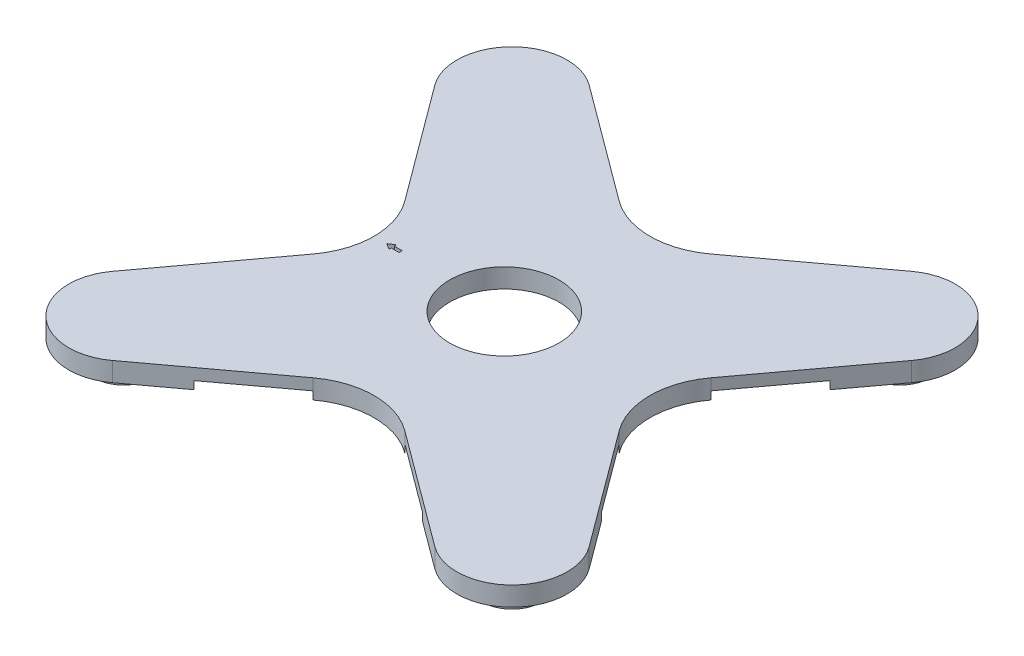
from build123d import *

# Parameters (mm, degrees)
SKETCH1_R           = 5
SKETCH1_R_2         = 9.017
BOSS_EXTRUDE1_DEPTH = 3.175
BOSS_EXTRUDE2_START = -3.175
SKETCH1_3_R         = 5
BOSS_EXTRUDE2_DEPTH = 6.35
CUT_EXTRUDE1_DEPTH  = 1.3


with BuildPart() as part:
    # Sketch1 → Boss-Extrude1 (new body)
    with BuildSketch(Plane(origin=(0, 0, 0), x_dir=(1, 0, 0), z_dir=(0, 1, 0))):
        with BuildLine():
            Line((-39.315149004, 26.587226943), (-25.231781425, 7.554111896))
            ThreePointArc((-25.231781425, 7.554111896), (-22.740865295, 0), (-25.231781425, -7.554111896))
            Line((-25.231781425, -7.554111896), (-39.315149004, -26.587226943))
            ThreePointArc((-39.315149004, -26.587226943), (-38.434652948, -38.434652948), (-26.587226943, -39.315149004))
            Line((-26.587226943, -39.315149004), (-7.554111896, -25.231781425))
            ThreePointArc((-7.554111896, -25.231781425), (0, -22.740865295), (7.554111896, -25.231781425))
            Line((7.554111896, -25.231781425), (26.587226943, -39.315149004))
            ThreePointArc((26.587226943, -39.315149004), (38.434652948, -38.434652948), (39.315149004, -26.587226943))
            Line((39.315149004, -26.587226943), (25.231781425, -7.554111896))
            ThreePointArc((25.231781425, -7.554111896), (22.740865295, 0), (25.231781425, 7.554111896))
            Line((25.231781425, 7.554111896), (39.315149004, 26.587226943))
            ThreePointArc((39.315149004, 26.587226943), (38.434652948, 38.434652948), (26.587226943, 39.315149004))
            Line((26.587226943, 39.315149004), (7.554111896, 25.231781425))
            ThreePointArc((7.554111896, 25.231781425), (0, 22.740865295), (-7.554111896, 25.231781425))
            Line((-7.554111896, 25.231781425), (-26.587226943, 39.315149004))
            ThreePointArc((-26.587226943, 39.315149004), (-38.434652948, 38.434652948), (-39.315149004, 26.587226943))
        make_face()
        with Locations(Location((-32, -32, 0), (0, 0, 270))):
            Circle(SKETCH1_R, mode=Mode.SUBTRACT)
        with Locations(Location((32, -32, 0), (0, 0, 270))):
            Circle(SKETCH1_R, mode=Mode.SUBTRACT)
        Polygon((-19.642190111, 0.635), (-19.642190111, 0.254), (-18.372190111, 0.254), (-18.372190111, -0.254), (-19.642190111, -0.254), (-19.642190111, -0.635), (-20.658190111, 0), align=None, mode=Mode.SUBTRACT)
        with Locations(Location((-1.27, 0, 0), (0, 0, 270))):
            Circle(SKETCH1_R_2, mode=Mode.SUBTRACT)
        with Locations(Location((-32, 32, 0), (0, 0, 270))):
            Circle(SKETCH1_R, mode=Mode.SUBTRACT)
        with Locations(Location((32, 32, 0), (0, 0, 270))):
            Circle(SKETCH1_R, mode=Mode.SUBTRACT)
    extrude(amount=BOSS_EXTRUDE1_DEPTH)

    # Sketch1<3> → Boss-Extrude2 (add)
    with BuildSketch(Plane(origin=(0, 0, 0), x_dir=(1, 0, 0), z_dir=(0, 1, 0)).offset(BOSS_EXTRUDE2_START)):
        with Locations(Location((-32, 32, 0), (0, 0, 270))):
            Circle(SKETCH1_3_R)
        with Locations(Location((32, -32, 0), (0, 0, 270))):
            Circle(SKETCH1_3_R)
        with Locations(Location((32, 32, 0), (0, 0, 270))):
            Circle(SKETCH1_3_R)
        with Locations(Location((-32, -32, 0), (0, 0, 270))):
            Circle(SKETCH1_3_R)
    extrude(amount=BOSS_EXTRUDE2_DEPTH)

    # Sketch2 → Cut-Extrude1 (cut)
    with BuildSketch(Plane.XZ):
        Polygon((-6.462290551, -24.423898886), (-24.423898886, -6.462290551), (-33.589527929, -18.849276199), (-18.849276199, -33.589527929), align=None)
        Polygon((-33.589527929, 18.849276199), (-18.849276199, 33.589527929), (-6.462290551, 24.423898886), (-24.423898886, 6.462290551), align=None)
        Polygon((24.423898886, 6.462290551), (33.589527929, 18.849276199), (18.849276199, 33.589527929), (6.462290551, 24.423898886), align=None)
        Polygon((33.589527929, -18.849276199), (18.849276199, -33.589527929), (6.462290551, -24.423898886), (24.423898886, -6.462290551), align=None)
    extrude(amount=-CUT_EXTRUDE1_DEPTH, mode=Mode.SUBTRACT)


solid = part.part
